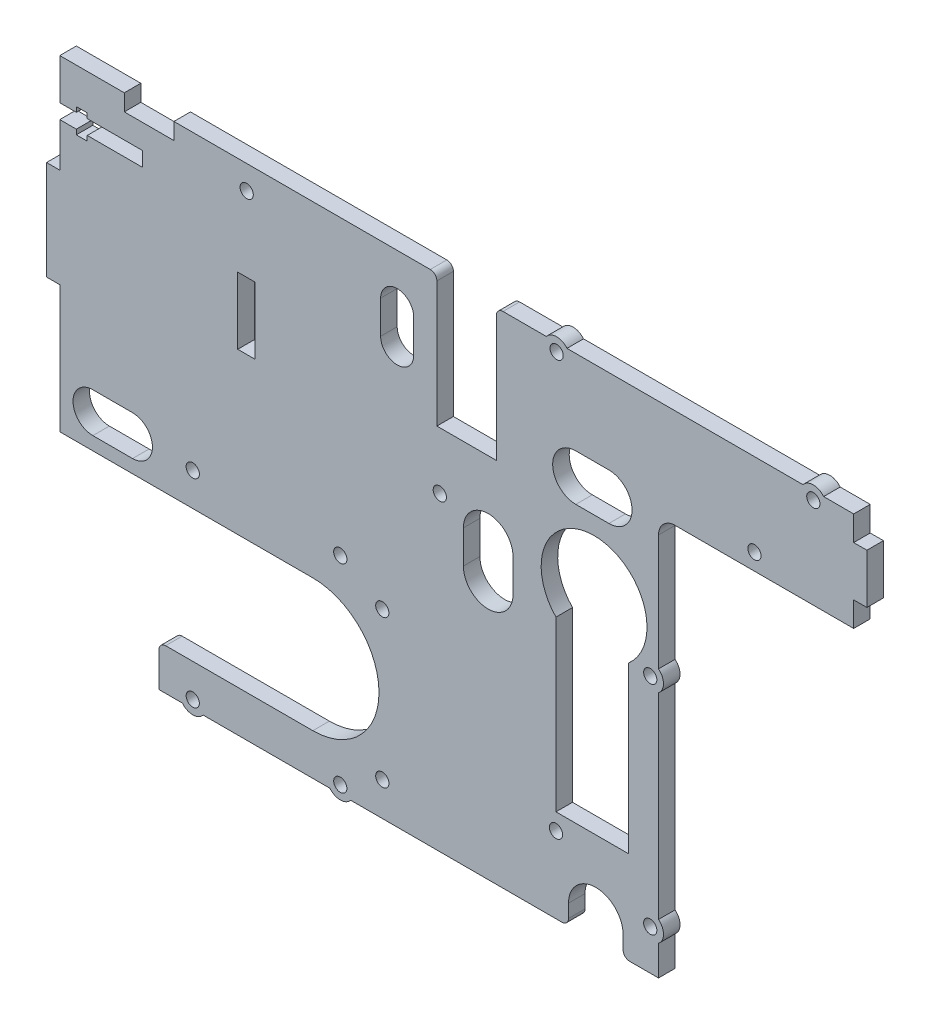
from build123d import *

# Parameters (mm, degrees)
SKETCH1_W                = 240
SKETCH1_H                = 151
BOSS_EXTRUDE1_DEPTH      = 5
SKETCH5_R                = 2
CUT_EXTRUDE1_DEPTH       = 5
SKETCH6_R                = 4
SKETCH6_R_2              = 2
BOSS_EXTRUDE2_DEPTH      = 5
CUT_EXTRUDE2_DEPTH       = 5
SKETCH8_W                = 30
SKETCH8_H                = 12.5
CUT_EXTRUDE3_DEPTH       = 5
SKETCH9_W                = 59
SKETCH9_H                = 121
CUT_EXTRUDE4_DEPTH       = 5
SKETCH12_W               = 18
SKETCH12_H               = 40
CUT_EXTRUDE7_DEPTH       = 10
SKETCH15_R               = 2
CUT_EXTRUDE9_DEPTH       = 5
SKETCH16_W               = 5.2
SKETCH16_H               = 20.2
CUT_EXTRUDE10_DEPTH      = 5
CUT_EXTRUDE11_DEPTH      = 10
CUT_EXTRUDE13_DEPTH      = 143.667445481
CUT_EXTRUDE13_DEPTH_BACK = 10
SKETCH23_R               = 2
CUT_EXTRUDE16_DEPTH      = 5
SKETCH24_R               = 4
SKETCH24_R_2             = 2
BOSS_EXTRUDE4_DEPTH      = 5
CUT_EXTRUDE19_DEPTH      = 10
SKETCH32_W               = 4
SKETCH32_H               = 30
SKETCH32_H_2             = 15
BOSS_EXTRUDE6_DEPTH      = 5
FILLET1_R                = 5
FILLET2_R                = 2
CUT_EXTRUDE22_DEPTH      = 5
SKETCH37_R               = 2
CUT_EXTRUDE25_DEPTH      = 10
SKETCH38_R               = 2
CUT_EXTRUDE26_DEPTH      = 10
CUT_EXTRUDE29_DEPTH      = 10
SKETCH43_R               = 2
CUT_EXTRUDE30_DEPTH      = 10
SKETCH44_R               = 4
SKETCH44_R_2             = 2
BOSS_EXTRUDE7_DEPTH      = 5
CUT_EXTRUDE31_DEPTH      = 10
CUT_EXTRUDE32_DEPTH      = 10
SKETCH47_R               = 2
CUT_EXTRUDE33_DEPTH      = 10
SKETCH48_W               = 15
SKETCH48_H               = 5
CUT_EXTRUDE34_DEPTH      = 5


with BuildPart() as part:
    # Sketch1 → Boss-Extrude1 (new body)
    with BuildSketch(Plane.XY):
        Rectangle(SKETCH1_W, SKETCH1_H)
    extrude(amount=BOSS_EXTRUDE1_DEPTH)

    # Sketch5 → Cut-Extrude1 (cut)
    with BuildSketch(Plane(origin=(0, 0, 0), x_dir=(-1, 0, 0), z_dir=(0, 0, -1))):
        with Locations((35.2, -73)):
            Circle(SKETCH5_R)
        with Locations((79.8, -73)):
            Circle(SKETCH5_R)
        with Locations((22.5, -65.3)):
            Circle(SKETCH5_R)
        with Locations(Location((22.5, -20.7, 0), (0, 0, 180))):
            Circle(SKETCH5_R)
        with Locations(Location((79.8, -13, 0), (0, 0, 180))):
            Circle(SKETCH5_R)
        with Locations(Location((35.2, -13, 0), (0, 0, 180))):
            Circle(SKETCH5_R)
    extrude(amount=-CUT_EXTRUDE1_DEPTH, mode=Mode.SUBTRACT)

    # Sketch6 → Boss-Extrude2 (add)
    # profile 1 of 2: a face of its own
    with BuildSketch(Plane(origin=(0, 0, 0), x_dir=(-1, 0, 0), z_dir=(0, 0, -1))):
        with Locations((35.2, -73)):
            Circle(SKETCH6_R)
        with Locations((35.2, -73)):
            Circle(SKETCH6_R_2, mode=Mode.SUBTRACT)
    # profile 2 of 2: a face of its own
    with BuildSketch(Plane(origin=(0, 0, 0), x_dir=(-1, 0, 0), z_dir=(0, 0, -1))):
        with Locations((79.8, -73)):
            Circle(SKETCH6_R)
        with Locations((79.8, -73)):
            Circle(SKETCH6_R_2, mode=Mode.SUBTRACT)
    extrude(amount=-BOSS_EXTRUDE2_DEPTH)

    # Sketch7 → Cut-Extrude2 (cut)
    with BuildSketch(Plane(origin=(0, 0, 0), x_dir=(-1, 0, 0), z_dir=(0, 0, -1))):
        with BuildLine():
            Line((120, -63), (43.5, -63))
            ThreePointArc((43.5, -63), (23.5, -43), (43.5, -23))
            Line((43.5, -23), (120, -23))
            Line((120, -23), (120, -63))
        make_face()
    extrude(amount=-CUT_EXTRUDE2_DEPTH, mode=Mode.SUBTRACT)

    # Sketch8 → Cut-Extrude3 (cut)
    with BuildSketch(Plane(origin=(0, 0, 0), x_dir=(-1, 0, 0), z_dir=(0, 0, -1))):
        with Locations((105, -69.25)):
            Rectangle(SKETCH8_W, SKETCH8_H)
    extrude(amount=-CUT_EXTRUDE3_DEPTH, mode=Mode.SUBTRACT)

    # Sketch9 → Cut-Extrude4 (cut)
    with BuildSketch(Plane(origin=(0, 0, 0), x_dir=(-1, 0, 0), z_dir=(0, 0, -1))):
        with Locations((-90.5, -15)):
            Rectangle(SKETCH9_W, SKETCH9_H)
    extrude(amount=-CUT_EXTRUDE4_DEPTH, mode=Mode.SUBTRACT)

    # Sketch12 → Cut-Extrude7 (cut)
    with BuildSketch(Plane(origin=(0, 0, 0), x_dir=(-1, 0, 0), z_dir=(0, 0, -1))):
        with Locations((-3, 55.5)):
            Rectangle(SKETCH12_W, SKETCH12_H)
    extrude(amount=-CUT_EXTRUDE7_DEPTH, mode=Mode.SUBTRACT)

    # Sketch15 → Cut-Extrude9 (cut)
    with BuildSketch(Plane.XY.offset(5)):
        with Locations((-63.5, 68.3)):
            Circle(SKETCH15_R)
    extrude(amount=-CUT_EXTRUDE9_DEPTH, mode=Mode.SUBTRACT)

    # Sketch16 → Cut-Extrude10 (cut)
    with BuildSketch(Plane(origin=(0, 0, 0), x_dir=(-1, 0, 0), z_dir=(0, 0, -1))):
        with Locations((63.6, 35.6)):
            Rectangle(SKETCH16_W, SKETCH16_H)
    extrude(amount=-CUT_EXTRUDE10_DEPTH, mode=Mode.SUBTRACT)

    # Sketch18 → Cut-Extrude11 (cut)
    with BuildSketch(Plane(origin=(0, 0, 0), x_dir=(-1, 0, 0), z_dir=(0, 0, -1))):
        with BuildLine():
            Line((-2.007007892, 12.8501367), (-2.007007892, 2.8501367))
            ThreePointArc((-2.007007892, 2.8501367), (-9.507007892, -4.6498633), (-17.007007892, 2.8501367))
            Line((-17.007007892, 2.8501367), (-17.007007892, 12.8501367))
            ThreePointArc((-17.007007892, 12.8501367), (-9.507007892, 20.3501367), (-2.007007892, 12.8501367))
        make_face()
    extrude(amount=-CUT_EXTRUDE11_DEPTH, mode=Mode.SUBTRACT)

    # Sketch20 → Cut-Extrude13 (cut, two sides: drawn at the far end of the back side and taken through both)
    with BuildSketch(Plane(origin=(0, 0, 0), x_dir=(-1, 0, 0), z_dir=(0, 0, -1)).offset(-CUT_EXTRUDE13_DEPTH_BACK)):
        with BuildLine():
            ThreePointArc((-33.7955627, -69.5), (-42.0455627, -61.25), (-50.2955627, -69.5))
            Line((-50.2955627, -69.5), (-50.2955627, -75.5))
            Line((-50.2955627, -75.5), (-33.7955627, -75.5))
            Line((-33.7955627, -75.5), (-33.7955627, -69.5))
        make_face()
    extrude(amount=CUT_EXTRUDE13_DEPTH + CUT_EXTRUDE13_DEPTH_BACK, mode=Mode.SUBTRACT)

    # Sketch23 → Cut-Extrude16 (cut)
    with BuildSketch(Plane(origin=(0, 0, 0), x_dir=(-1, 0, 0), z_dir=(0, 0, -1))):
        with Locations((-107.8, 73)):
            Circle(SKETCH23_R)
        with Locations((-30.2, 73)):
            Circle(SKETCH23_R)
    extrude(amount=-CUT_EXTRUDE16_DEPTH, mode=Mode.SUBTRACT)

    # Sketch24 → Boss-Extrude4 (add)
    # profile 1 of 2: a face of its own
    with BuildSketch(Plane(origin=(0, 0, 0), x_dir=(-1, 0, 0), z_dir=(0, 0, -1))):
        with Locations((-107.8, 73)):
            Circle(SKETCH24_R)
        with Locations((-107.8, 73)):
            Circle(SKETCH24_R_2, mode=Mode.SUBTRACT)
    # profile 2 of 2: a face of its own
    with BuildSketch(Plane(origin=(0, 0, 0), x_dir=(-1, 0, 0), z_dir=(0, 0, -1))):
        with Locations((-30.2, 73)):
            Circle(SKETCH24_R)
        with Locations((-30.2, 73)):
            Circle(SKETCH24_R_2, mode=Mode.SUBTRACT)
    extrude(amount=-BOSS_EXTRUDE4_DEPTH)

    # Sketch30 → Cut-Extrude19 (cut)
    with BuildSketch(Plane(origin=(0, 0, 0), x_dir=(-1, 0, 0), z_dir=(0, 0, -1))):
        with BuildLine():
            Line((110, -19), (98, -19))
            ThreePointArc((98, -19), (92, -13), (98, -7))
            Line((98, -7), (110, -7))
            ThreePointArc((110, -7), (116, -13), (110, -19))
        make_face()
    extrude(amount=-CUT_EXTRUDE19_DEPTH, mode=Mode.SUBTRACT)

    # Sketch32 → Boss-Extrude6 (add)
    with BuildSketch(Plane(origin=(0, 0, 0), x_dir=(-1, 0, 0), z_dir=(0, 0, -1))):
        with Locations((122, 30.5)):
            Rectangle(SKETCH32_W, SKETCH32_H)
        with Locations((-122, 60.5)):
            Rectangle(SKETCH32_W, SKETCH32_H_2)
    extrude(amount=-BOSS_EXTRUDE6_DEPTH)

    # Fillet1
    fillet1_edges = [part.edges().sort_by_distance(p)[0] for p in [
        (61, 45.5, 2.5),
    ]]
    fillet(fillet1_edges, radius=FILLET1_R)

    # Fillet2
    fillet2_edges = [part.edges().sort_by_distance(p)[0] for p in [
        (12, 75.5, 2.5),
        (-6, 75.5, 2.5),
        (33.7955627, -75.5, 2.5),
        (50.2955627, -75.5, 2.5),
        (-90, -63, 2.5),
    ]]
    fillet(fillet2_edges, radius=FILLET2_R)

    # Sketch34 → Cut-Extrude22 (cut)
    with BuildSketch(Plane(origin=(0, 0, 0), x_dir=(-1, 0, 0), z_dir=(0, 0, -1))):
        Polygon((115, 58.736739195), (120, 58.736739195), (120, 63.136739195), (115, 63.136739195), (115, 64.636739195), (111.7, 64.636739195), (111.7, 63.136739195), (95, 63.136739195), (95, 58.736739195), (111.7, 58.736739195), (111.7, 57.236739195), (115, 57.236739195), align=None)
    extrude(amount=-CUT_EXTRUDE22_DEPTH, mode=Mode.SUBTRACT)

    # Sketch37 → Cut-Extrude25 (cut)
    with BuildSketch(Plane(origin=(0, 0, 0), x_dir=(-1, 0, 0), z_dir=(0, 0, -1))):
        with Locations((-30, -52.5)):
            Circle(SKETCH37_R)
    extrude(amount=-CUT_EXTRUDE25_DEPTH, mode=Mode.SUBTRACT)

    # Sketch38 → Cut-Extrude26 (cut)
    with BuildSketch(Plane(origin=(0, 0, 0), x_dir=(-1, 0, 0), z_dir=(0, 0, -1))):
        with Locations((5.115159436, 18.266698226)):
            Circle(SKETCH38_R)
    extrude(amount=-CUT_EXTRUDE26_DEPTH, mode=Mode.SUBTRACT)

    # Sketch42 → Cut-Extrude29 (cut)
    with BuildSketch(Plane(origin=(0, 0, 0), x_dir=(-1, 0, 0), z_dir=(0, 0, -1))):
        with BuildLine():
            Line((-52, -47.5), (-52, 2.5))
            ThreePointArc((-52, 2.5), (-42.236373755, 30.573885063), (-30, 3.486201934))
            Line((-30, 3.486201934), (-30, -47.5))
            Line((-30, -47.5), (-52, -47.5))
        make_face()
    extrude(amount=-CUT_EXTRUDE29_DEPTH, mode=Mode.SUBTRACT)

    # Sketch43 → Cut-Extrude30 (cut)
    with BuildSketch(Plane(origin=(0, 0, 0), x_dir=(-1, 0, 0), z_dir=(0, 0, -1))):
        with Locations((-58.5, 2.3)):
            Circle(SKETCH43_R)
        with Locations((-58.5, -63.3)):
            Circle(SKETCH43_R)
    extrude(amount=-CUT_EXTRUDE30_DEPTH, mode=Mode.SUBTRACT)

    # Sketch44 → Boss-Extrude7 (add)
    # profile 1 of 2: a face of its own
    with BuildSketch(Plane(origin=(0, 0, 0), x_dir=(-1, 0, 0), z_dir=(0, 0, -1))):
        with Locations((-58.5, 2.3)):
            Circle(SKETCH44_R)
        with Locations((-58.5, 2.3)):
            Circle(SKETCH44_R_2, mode=Mode.SUBTRACT)
    # profile 2 of 2: a face of its own
    with BuildSketch(Plane(origin=(0, 0, 0), x_dir=(-1, 0, 0), z_dir=(0, 0, -1))):
        with Locations((-58.5, -63.3)):
            Circle(SKETCH44_R)
        with Locations((-58.5, -63.3)):
            Circle(SKETCH44_R_2, mode=Mode.SUBTRACT)
    extrude(amount=-BOSS_EXTRUDE7_DEPTH)

    # Sketch45 → Cut-Extrude31 (cut)
    with BuildSketch(Plane(origin=(0, 0, 0), x_dir=(-1, 0, 0), z_dir=(0, 0, -1))):
        with BuildLine():
            Line((23, 60.5), (23, 50.5))
            ThreePointArc((23, 50.5), (18, 45.5), (13, 50.5))
            Line((13, 50.5), (13, 60.5))
            ThreePointArc((13, 60.5), (18, 65.5), (23, 60.5))
        make_face()
    extrude(amount=-CUT_EXTRUDE31_DEPTH, mode=Mode.SUBTRACT)

    # Sketch46 → Cut-Extrude32 (cut)
    with BuildSketch(Plane(origin=(0, 0, 0), x_dir=(-1, 0, 0), z_dir=(0, 0, -1))):
        with BuildLine():
            Line((-46, 50), (-36, 50))
            ThreePointArc((-36, 50), (-29, 43), (-36, 36))
            Line((-36, 36), (-46, 36))
            ThreePointArc((-46, 36), (-53, 43), (-46, 50))
        make_face()
    extrude(amount=-CUT_EXTRUDE32_DEPTH, mode=Mode.SUBTRACT)

    # Sketch47 → Cut-Extrude33 (cut)
    with BuildSketch(Plane(origin=(0, 0, 0), x_dir=(-1, 0, 0), z_dir=(0, 0, -1))):
        with Locations((-90, 50.5)):
            Circle(SKETCH47_R)
    extrude(amount=-CUT_EXTRUDE33_DEPTH, mode=Mode.SUBTRACT)

    # Sketch48 → Cut-Extrude34 (cut)
    with BuildSketch(Plane(origin=(0, 0, 0), x_dir=(-1, 0, 0), z_dir=(0, 0, -1))):
        with Locations((93, 73)):
            Rectangle(SKETCH48_W, SKETCH48_H)
    extrude(amount=-CUT_EXTRUDE34_DEPTH, mode=Mode.SUBTRACT)


solid = part.part
